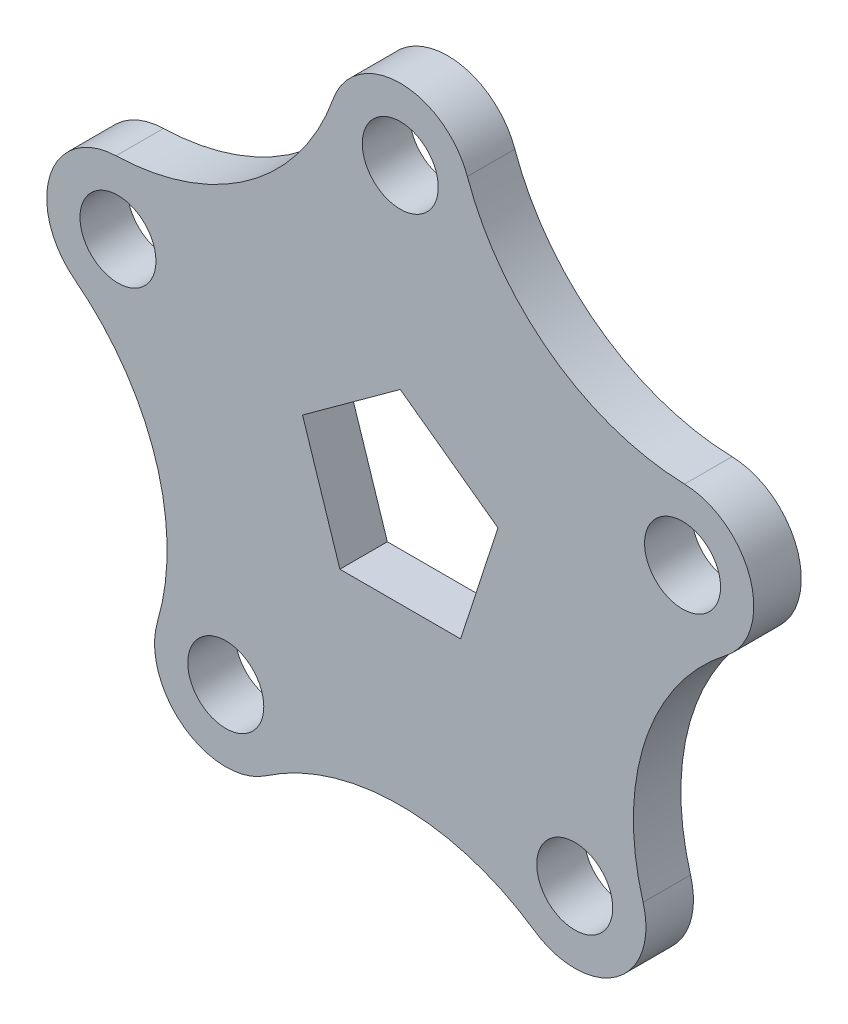
from build123d import *

# Parameters (mm, degrees)
SKETCH1_R           = 8
BOSS_EXTRUDE1_DEPTH = 10


with BuildPart() as part:
    # Sketch1 → Boss-Extrude1 (new body)
    with BuildSketch(Plane.XY):
        with BuildLine():
            ThreePointArc((59.85601991, 34.307820558), (31.850049433, 43.837832205), (14.132148934, 67.528157367))
            ThreePointArc((14.132148934, 67.528157367), (0, 77.5), (-14.132148934, 67.528157367))
            ThreePointArc((-14.132148934, 67.528157367), (-31.850049433, 43.837832205), (-59.85601991, 34.307820558))
            ThreePointArc((-59.85601991, 34.307820558), (-73.706880013, 23.948817064), (-68.590168285, 7.426875892))
            ThreePointArc((-68.590168285, 7.426875892), (-51.534462525, -16.744561909), (-51.125203669, -46.324758182))
            ThreePointArc((-51.125203669, -46.324758182), (-45.553357053, -62.698817064), (-28.25890636, -62.938095635))
            ThreePointArc((-28.25890636, -62.938095635), (0, -54.186540592), (28.25890636, -62.938095635))
            ThreePointArc((28.25890636, -62.938095635), (45.553357053, -62.698817064), (51.125203669, -46.324758182))
            ThreePointArc((51.125203669, -46.324758182), (51.534462525, -16.744561909), (68.590168285, 7.426875892))
            ThreePointArc((68.590168285, 7.426875892), (73.706880013, 23.948817064), (59.85601991, 34.307820558))
        make_face()
        with BuildLine():
            ThreePointArc((-28.736578268, -50.563562148), (-43.864630462, -54.195486146), (-32.03429625, -44.091426193))
            ThreePointArc((-32.03429625, -44.091426193), (-29.608526075, -46.931638151), (-28.736578268, -50.563562148))
        make_face(mode=Mode.SUBTRACT)
        Polygon((-20.57248383, 6.684405197), (0, 21.631189606), (20.57248383, 6.684405197), (12.71449424, -17.5), (-12.71449424, -17.5), align=None, mode=Mode.SUBTRACT)
        with BuildLine():
            ThreePointArc((44.736578268, -50.563562148), (33.10465427, -57.691614342), (32.03429625, -44.091426193))
            ThreePointArc((32.03429625, -44.091426193), (40.368502266, -43.435509955), (44.736578268, -50.563562148))
        make_face(mode=Mode.SUBTRACT)
        with BuildLine():
            ThreePointArc((-51.441032268, 19.313562148), (-51.539525544, 18.062086428), (-51.832580138, 16.841426193))
            ThreePointArc((-51.832580138, 16.841426193), (-67.342538993, 20.565037869), (-51.441032268, 19.313562148))
        make_face(mode=Mode.SUBTRACT)
        with Locations((0, 62.5)):
            Circle(SKETCH1_R, mode=Mode.SUBTRACT)
        with BuildLine():
            ThreePointArc((67.441032268, 19.313562148), (60.692507989, 11.412055424), (51.832580138, 16.841426193))
            ThreePointArc((51.832580138, 16.841426193), (58.189556548, 27.215068873), (67.441032268, 19.313562148))
        make_face(mode=Mode.SUBTRACT)
    extrude(amount=BOSS_EXTRUDE1_DEPTH)


solid = part.part
